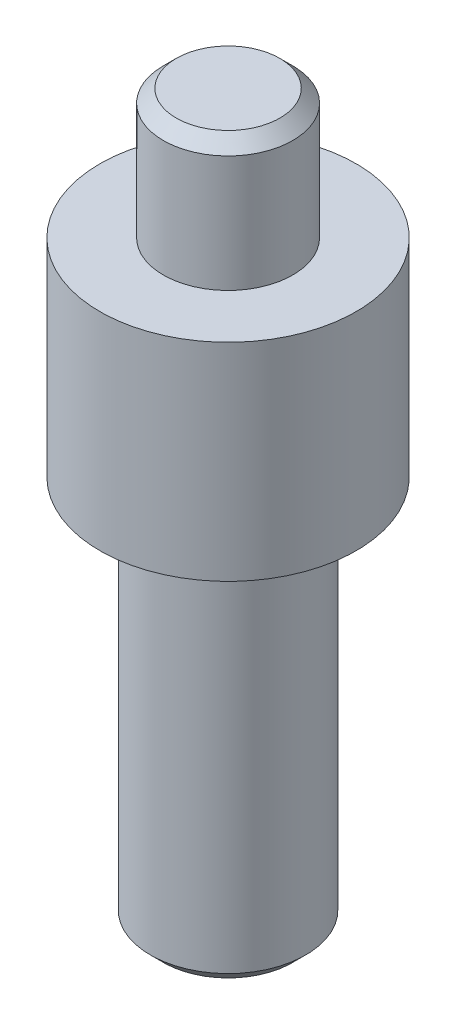
from build123d import *

# Parameters (mm, degrees)
SCHIZZO1_R                   = 3
ESTRUSIONE_ESTRUSIONE1_DEPTH = 15
SCHIZZO2_R                   = 4.95
ESTRUSIONE_ESTRUSIONE2_DEPTH = 8
SMUSSO1_SIZE                 = 0.5
SCHIZZO4_R                   = 2.5
ESTRUSIONE_ESTRUSIONE5_DEPTH = 5
SMUSSO2_SIZE                 = 0.5


with BuildPart() as part:
    # Schizzo1 → Estrusione-Estrusione1 (new body)
    with BuildSketch(Plane(origin=(0, 0, 0), x_dir=(1, 0, 0), z_dir=(0, 1, 0))):
        with Locations(Location((0, 0, 0), (0, 0, 180))):
            Circle(SCHIZZO1_R)
    extrude(amount=-ESTRUSIONE_ESTRUSIONE1_DEPTH)

    # Schizzo2 → Estrusione-Estrusione2 (add)
    with BuildSketch(Plane(origin=(0, 0, 0), x_dir=(1, 0, 0), z_dir=(0, 1, 0))):
        with Locations(Location((0, 0, 0), (0, 0, 180))):
            Circle(SCHIZZO2_R)
    extrude(amount=ESTRUSIONE_ESTRUSIONE2_DEPTH)

    # Smusso1
    smusso1_edges = [part.edges().sort_by_distance(p)[0] for p in [
        (3, -15, 0),
    ]]
    chamfer(smusso1_edges, length=SMUSSO1_SIZE)

    # Schizzo4 → Estrusione-Estrusione5 (add)
    with BuildSketch(Plane(origin=(0, 8, 0), x_dir=(1, 0, 0), z_dir=(0, 1, 0))):
        with Locations(Location((0, 0, 0), (0, 0, 180))):
            Circle(SCHIZZO4_R)
    extrude(amount=ESTRUSIONE_ESTRUSIONE5_DEPTH)

    # Smusso2
    smusso2_edges = [part.edges().sort_by_distance(p)[0] for p in [
        (2.5, 13, 0),
    ]]
    chamfer(smusso2_edges, length=SMUSSO2_SIZE)


solid = part.part
